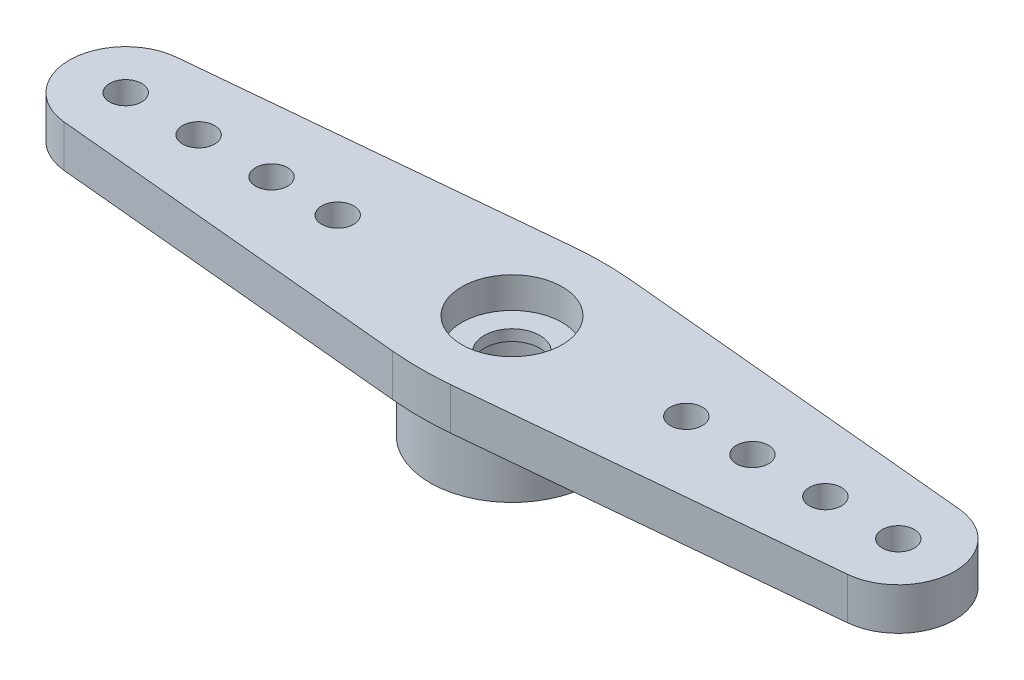
from build123d import *

# Parameters (mm, degrees)
SKETCH1_R           = 3.3655
SKETCH1_R_2         = 2.2352
BOSS_EXTRUDE1_DEPTH = 2.54
SKETCH2_R           = 0.6604
SKETCH2_R_2         = 2.31775
SKETCH2_R_3         = 3.3655
SKETCH2_R_4         = 2.2352
SKETCH2_R_5         = 1.143
BOSS_EXTRUDE2_DEPTH = 1.7272
FILLET1_R           = 12.7
CUT_EXTRUDE1_START  = -1.27
SKETCH3_R           = 2.06375
SKETCH3_R_2         = 1.143
CUT_EXTRUDE1_DEPTH  = 1.27


with BuildPart() as part:
    # Sketch1 → Boss-Extrude1 (new body)
    with BuildSketch(Plane(origin=(0, 0, 0), x_dir=(1, 0, 0), z_dir=(0, 1, 0))):
        with Locations(Location((0, 0, 0), (0, 0, 270))):
            Circle(SKETCH1_R)
        with Locations(Location((0, 0, 0), (0, 0, 270))):
            Circle(SKETCH1_R_2, mode=Mode.SUBTRACT)
    extrude(amount=BOSS_EXTRUDE1_DEPTH)

    # Sketch2 → Boss-Extrude2 (add)
    # profile 1 of 7: a face of its own
    with BuildSketch(Plane(origin=(0, 2.54, 0), x_dir=(1, 0, 0), z_dir=(0, 1, 0))):
        with BuildLine():
            ThreePointArc((-0.713521748, -3.755518873), (-3.8227, 0), (-0.713521748, 3.755518873))
            Line((-0.713521748, 3.755518873), (-16.092265178, 2.307544345))
            ThreePointArc((-16.092265178, 2.307544345), (-14.314807913, 1.713991165), (-13.55725, 0))
            ThreePointArc((-13.55725, 0), (-14.314807913, -1.713991165), (-16.092265178, -2.307544345))
            Line((-16.092265178, -2.307544345), (-0.713521748, -3.755518873))
        make_face()
        with Locations(Location((-12.8778, 0, 0), (0, 0, 270))):
            Circle(SKETCH2_R, mode=Mode.SUBTRACT)
        with Locations(Location((-9.8806, 0, 0), (0, 0, 270))):
            Circle(SKETCH2_R, mode=Mode.SUBTRACT)
        with Locations(Location((-7.1628, 0, 0), (0, 0, 270))):
            Circle(SKETCH2_R, mode=Mode.SUBTRACT)
    # profile 2 of 7: a face of its own
    with BuildSketch(Plane(origin=(0, 2.54, 0), x_dir=(1, 0, 0), z_dir=(0, 1, 0))):
        with Locations((-15.875, 0)):
            Circle(SKETCH2_R_2)
        with Locations(Location((-15.875, 0, 0), (0, 0, 270))):
            Circle(SKETCH2_R, mode=Mode.SUBTRACT)
    # profile 3 of 7: a face of its own
    with BuildSketch(Plane(origin=(0, 2.54, 0), x_dir=(1, 0, 0), z_dir=(0, 1, 0))):
        with BuildLine():
            Line((16.092265178, 2.307544345), (0.713521748, 3.755518873))
            ThreePointArc((0.713521748, 3.755518873), (2.944538578, 2.437771083), (3.8227, 0))
            ThreePointArc((3.8227, 0), (2.944538578, -2.437771083), (0.713521748, -3.755518873))
            Line((0.713521748, -3.755518873), (16.092265178, -2.307544345))
            ThreePointArc((16.092265178, -2.307544345), (13.55725, 0), (16.092265178, 2.307544345))
        make_face()
        with Locations(Location((7.1628, 0, 0), (0, 0, 270))):
            Circle(SKETCH2_R, mode=Mode.SUBTRACT)
        with Locations(Location((9.8806, 0, 0), (0, 0, 270))):
            Circle(SKETCH2_R, mode=Mode.SUBTRACT)
        with Locations(Location((12.8778, 0, 0), (0, 0, 270))):
            Circle(SKETCH2_R, mode=Mode.SUBTRACT)
    # profile 4 of 7: a face of its own
    with BuildSketch(Plane(origin=(0, 2.54, 0), x_dir=(1, 0, 0), z_dir=(0, 1, 0))):
        with Locations((15.875, 0)):
            Circle(SKETCH2_R_2)
        with Locations(Location((15.875, 0, 0), (0, 0, 270))):
            Circle(SKETCH2_R, mode=Mode.SUBTRACT)
    # profile 5 of 7: a face of its own
    with BuildSketch(Plane(origin=(0, 2.54, 0), x_dir=(1, 0, 0), z_dir=(0, 1, 0))):
        with BuildLine():
            Line((0.713521748, 3.755518873), (0, 3.8227))
            Line((0, 3.8227), (-0.713521748, 3.755518873))
            ThreePointArc((-0.713521748, 3.755518873), (-3.8227, 0), (-0.713521748, -3.755518873))
            Line((-0.713521748, -3.755518873), (0, -3.8227))
            Line((0, -3.8227), (0.713521748, -3.755518873))
            ThreePointArc((0.713521748, -3.755518873), (2.944538578, -2.437771083), (3.8227, 0))
            ThreePointArc((3.8227, 0), (2.944538578, 2.437771083), (0.713521748, 3.755518873))
        make_face()
        with Locations(Location((0, 0, 0), (0, 0, 270))):
            Circle(SKETCH2_R_3, mode=Mode.SUBTRACT)
    # profile 6 of 7: a face of its own
    with BuildSketch(Plane(origin=(0, 2.54, 0), x_dir=(1, 0, 0), z_dir=(0, 1, 0))):
        with Locations(Location((0, 0, 0), (0, 0, 270))):
            Circle(SKETCH2_R_3)
        with Locations(Location((0, 0, 0), (0, 0, 270))):
            Circle(SKETCH2_R_4, mode=Mode.SUBTRACT)
    # profile 7 of 7: a face of its own
    with BuildSketch(Plane(origin=(0, 2.54, 0), x_dir=(1, 0, 0), z_dir=(0, 1, 0))):
        with Locations(Location((0, 0, 0), (0, 0, 270))):
            Circle(SKETCH2_R_4)
        with Locations(Location((0, 0, 0), (0, 0, 270))):
            Circle(SKETCH2_R_5, mode=Mode.SUBTRACT)
    extrude(amount=BOSS_EXTRUDE2_DEPTH)

    # Fillet1
    fillet1_edges = [part.edges().sort_by_distance(p)[0] for p in [
        (0, 3.4036, -3.8227),
        (0, 3.4036, 3.8227),
    ]]
    fillet(fillet1_edges, radius=FILLET1_R)

    # Sketch3 → Cut-Extrude1 (cut)
    with BuildSketch(Plane(origin=(0, 4.2672, 0), x_dir=(1, 0, 0), z_dir=(0, 1, 0)).offset(CUT_EXTRUDE1_START)):
        with Locations(Location((0, 0, 0), (0, 0, 270))):
            Circle(SKETCH3_R)
        with Locations(Location((0, 0, 0), (0, 0, 270))):
            Circle(SKETCH3_R_2, mode=Mode.SUBTRACT)
    extrude(amount=CUT_EXTRUDE1_DEPTH, mode=Mode.SUBTRACT)


solid = part.part
